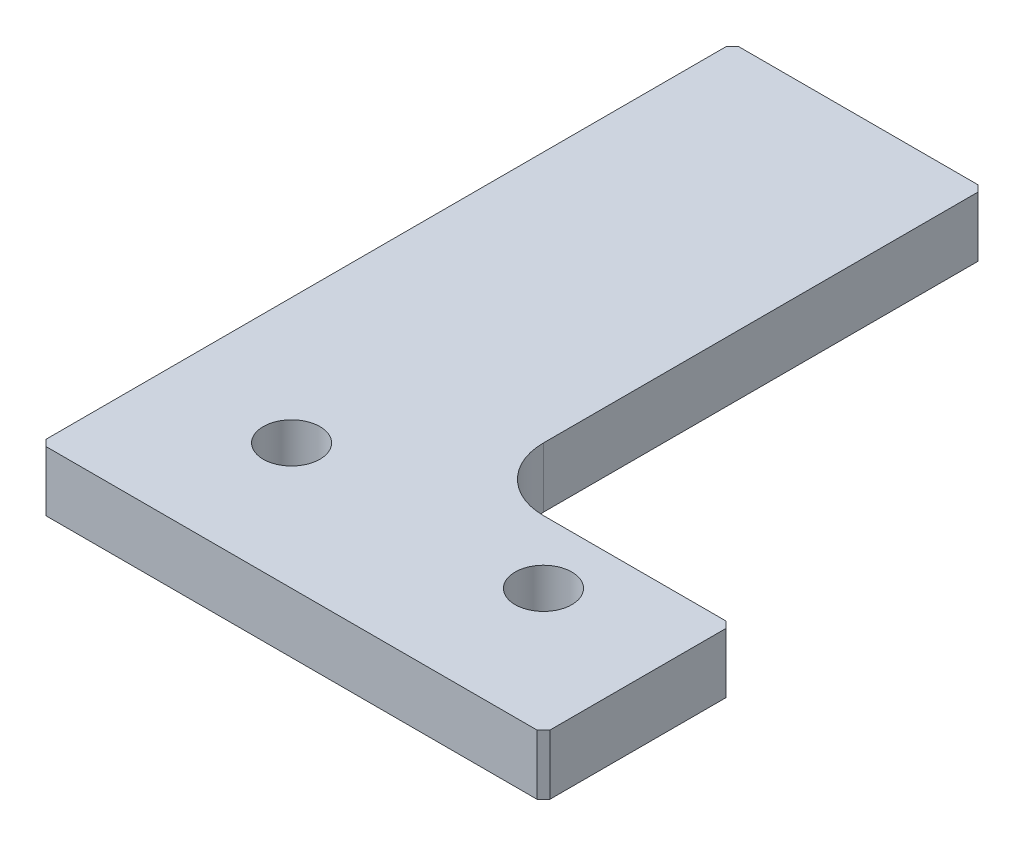
from build123d import *

# Parameters (mm, degrees)
BOSS_EXTRUDE1_DEPTH  = 9.525
M8_CLEARANCE_HOLE1_D = 9
FILLET1_R            = 10
CHAMFER1_SIZE        = 1


with BuildPart() as part:
    # Sketch1 → Boss-Extrude1 (new body)
    with BuildSketch(Plane(origin=(0, 0, 0), x_dir=(1, 0, 0), z_dir=(0, 1, 0))):
        Polygon((-20, 90), (-20, -20), (60, -20), (60, 10), (20, 10), (20, 90), align=None)
    extrude(amount=BOSS_EXTRUDE1_DEPTH)

    # M8 Clearance Hole1 (through all)
    with Locations(Plane(origin=(0, 9.525, 0), x_dir=(1, 0, 0), z_dir=(0, 1, 0))):
        with Locations((0, 0), (40, 0)):
            Hole(M8_CLEARANCE_HOLE1_D / 2)

    # Fillet1
    fillet1_edges = [part.edges().sort_by_distance(p)[0] for p in [
        (20, 4.7625, -10),
    ]]
    fillet(fillet1_edges, radius=FILLET1_R)

    # Chamfer1
    chamfer1_edges = [part.edges().sort_by_distance(p)[0] for p in [
        (20, 4.7625, -90),
        (60, 4.7625, -10),
        (60, 4.7625, 20),
        (-20, 4.7625, 20),
        (-20, 4.7625, -90),
    ]]
    chamfer(chamfer1_edges, length=CHAMFER1_SIZE)


solid = part.part
